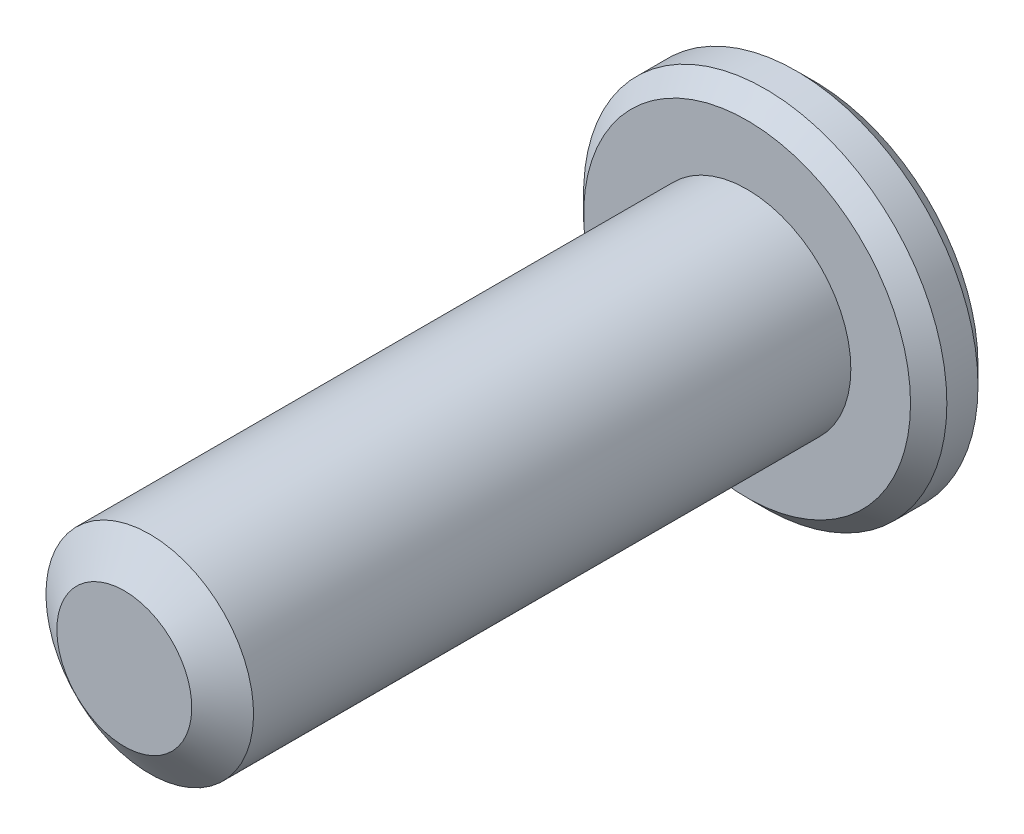
from build123d import *

# Parameters (mm, degrees)
SKETCH1_R          = 2
EXTRUDE1_DEPTH     = 13.3
SKETCH6_R          = 3.5
EXTRUDE2_DEPTH     = 1.3
CUT_EXTRUDE1_DEPTH = 0.975
SKETCH8_R          = 1.443375673
CUT_EXTRUDE2_DEPTH = 0.975
CUT_EXTRUDE2_TAPER = 45
CHAMFER1_SIZE      = 0.35


with BuildPart() as part:
    # Sketch1 → Extrude1 (new body)
    with BuildSketch(Plane.XY):
        Circle(SKETCH1_R)
    extrude(amount=EXTRUDE1_DEPTH)

    # Sketch4 → Cut-Revolve1 (revolve, cut)
    with BuildSketch(Plane(origin=(0, 0, 0), x_dir=(0, 0, -1), z_dir=(1, 0, 0))):
        Polygon((-12.809854723, 2), (-13.3, 1.3), (-13.3, 2), align=None)
    revolve(axis=Axis((0, 0, 0), (0, 0, 1)), mode=Mode.SUBTRACT)

    # Sketch6 → Extrude2 (add)
    with BuildSketch(Plane.XY):
        Circle(SKETCH6_R)
    extrude(amount=EXTRUDE2_DEPTH)

    # Sketch7 → Cut-Extrude1 (cut)
    with BuildSketch(Plane.XY):
        Polygon((0, 1.443375673), (-1.25, 0.721687836), (-1.25, -0.721687836), (0, -1.443375673), (1.25, -0.721687836), (1.25, 0.721687836), align=None)
    extrude(amount=CUT_EXTRUDE1_DEPTH, mode=Mode.SUBTRACT)

    # Sketch8 → Cut-Extrude2 (cut)
    with BuildSketch(Plane.XY):
        Circle(SKETCH8_R)
    extrude(amount=CUT_EXTRUDE2_DEPTH, taper=CUT_EXTRUDE2_TAPER, mode=Mode.SUBTRACT)

    # Chamfer1
    chamfer1_edges = [part.edges().sort_by_distance(p)[0] for p in [
        (-3.5, 0, 1.3),
        (-3.5, 0, 0),
    ]]
    chamfer(chamfer1_edges, length=CHAMFER1_SIZE)


solid = part.part
